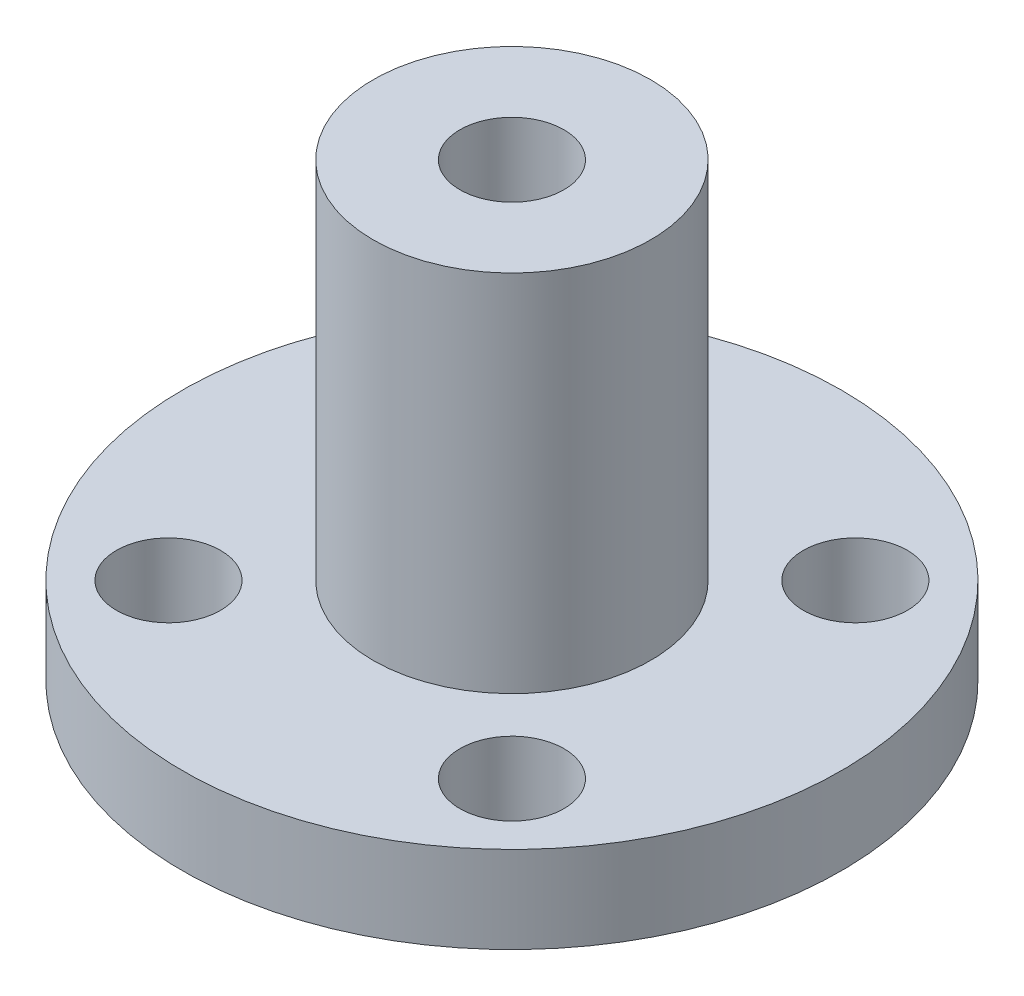
from build123d import *

# Parameters (mm, degrees)
SKETCH2_R          = 1.5
CUT_EXTRUDE1_DEPTH = 31


with BuildPart() as part:
    # Sketch1 → Revolve1 (revolve)
    with BuildSketch(Plane.XY, mode=Mode.PRIVATE) as revolve1_sk:
        Polygon((-1.5, -1.224136042), (-9.5, -1.224136042), (-9.5, 1.275863958), (-4, 1.275863958), (-4, 11.775863958), (-1.5, 11.775863958), align=None)
    revolve(revolve1_sk.sketch.rotate(Axis((0, -0.965665236, 0), (0, 1, 0)), 270), axis=Axis((0, -0.965665236, 0), (0, 1, 0)))

    # Sketch2 → Cut-Extrude1 (cut)
    with BuildSketch(Plane.XZ.offset(1.224136042)):
        with Locations(Location((-4.949747468, 4.949747468, 0), (0, 0, 270))):
            Circle(SKETCH2_R)
        with Locations(Location((4.949747468, 4.949747468, 0), (0, 0, 270))):
            Circle(SKETCH2_R)
        with Locations(Location((4.949747468, -4.949747468, 0), (0, 0, 270))):
            Circle(SKETCH2_R)
        with Locations(Location((-4.949747468, -4.949747468, 0), (0, 0, 270))):
            Circle(SKETCH2_R)
    extrude(amount=-CUT_EXTRUDE1_DEPTH, mode=Mode.SUBTRACT)


solid = part.part
